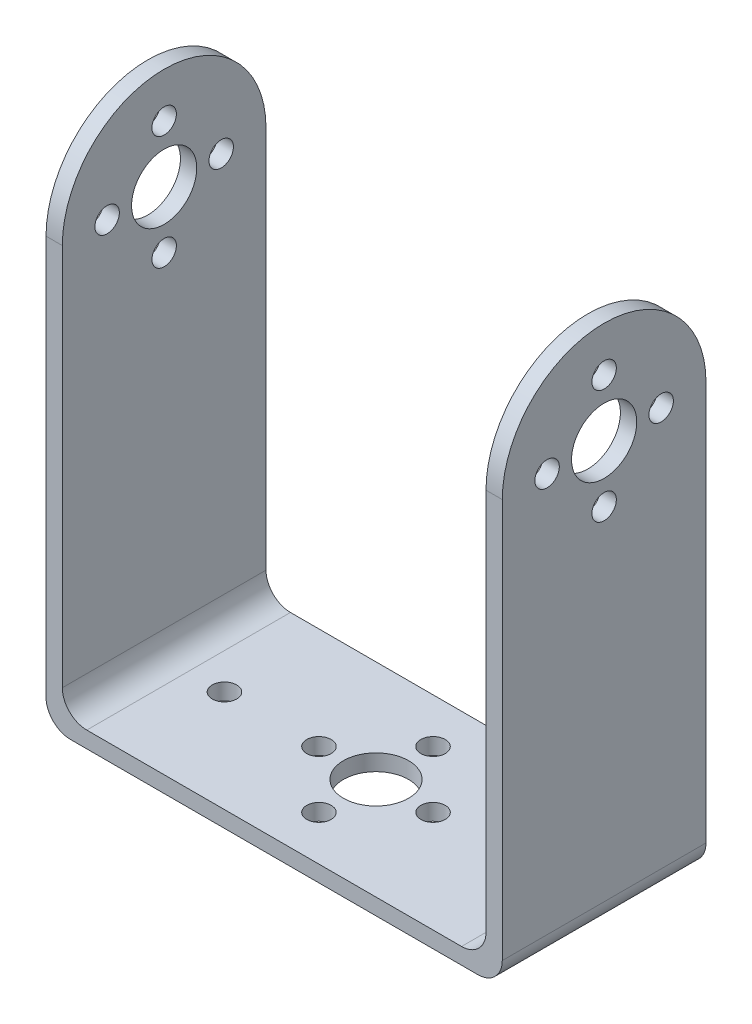
from build123d import *

# Parameters (mm, degrees)
SKETCH_1_W          = 52
SKETCH_1_H          = 25
SKETCH_1_R          = 1.5
SKETCH_1_R_2        = 4
EXTRUDE_1_DEPTH     = 2
SKETCH_2_W          = 2
SKETCH_2_H          = 25
EXTRUDE_2_DEPTH     = 64.5
CUT_EXTRUDE_2_REACH = 91.001
SKETCH_3_R          = 1.5
FILLET_1_R          = 3


with BuildPart() as part:
    # 草图1 → 凸台-拉伸1 (new body)
    with BuildSketch(Plane(origin=(0, 0, 0), x_dir=(1, 0, 0), z_dir=(0, 1, 0))):
        with Locations((26, -12.5)):
            Rectangle(SKETCH_1_W, SKETCH_1_H)
        with Locations(Location((44.6, -12.5, 0), (0, 0, 270))):
            Circle(SKETCH_1_R, mode=Mode.SUBTRACT)
        with Locations(Location((26, -12.5, 0), (0, 0, 270))):
            Circle(SKETCH_1_R_2, mode=Mode.SUBTRACT)
        with Locations(Location((26, -19.5, 0), (0, 0, 270))):
            Circle(SKETCH_1_R, mode=Mode.SUBTRACT)
        with Locations(Location((19, -12.5, 0), (0, 0, 270))):
            Circle(SKETCH_1_R, mode=Mode.SUBTRACT)
        with Locations(Location((26, -5.5, 0), (0, 0, 270))):
            Circle(SKETCH_1_R, mode=Mode.SUBTRACT)
        with Locations(Location((33, -12.5, 0), (0, 0, 270))):
            Circle(SKETCH_1_R, mode=Mode.SUBTRACT)
        with Locations(Location((7.4, -12.5, 0), (0, 0, 90))):
            Circle(SKETCH_1_R, mode=Mode.SUBTRACT)
    extrude(amount=EXTRUDE_1_DEPTH)

    # 草图2 → 凸台-拉伸2 (add)
    with BuildSketch(Plane(origin=(0, 0, 0), x_dir=(1, 0, 0), z_dir=(0, 1, 0))):
        with Locations((-1, -12.5)):
            Rectangle(SKETCH_2_W, SKETCH_2_H)
        with Locations((53, -12.5)):
            Rectangle(SKETCH_2_W, SKETCH_2_H)
    extrude(amount=EXTRUDE_2_DEPTH)

    # 切除-拉伸2: up to this face of the body (flat: up to its plane)
    cut_extrude_2_end = Plane(part.part.faces().sort_by_distance((54, 32.25, 12.5))[0])
    # 草图3 → 切除-拉伸2 (cut, up to the picked face)
    with BuildSketch(Plane.ZY.offset(2), mode=Mode.PRIVATE) as cut_extrude_2_sk1:
        with BuildLine():
            Line((0, 64.5), (0, 52))
            ThreePointArc((0, 52), (3.661165235, 60.838834765), (12.5, 64.5))
            Line((12.5, 64.5), (0, 64.5))
        make_face()
    cut_extrude_2_tool1 = split(extrude(cut_extrude_2_sk1.sketch, amount=-CUT_EXTRUDE_2_REACH, mode=Mode.PRIVATE), bisect_by=cut_extrude_2_end, keep=Keep.BOTH, mode=Mode.PRIVATE)
    # 草图3 → 切除-拉伸2 (cut, up to the picked face)
    with BuildSketch(Plane.ZY.offset(2), mode=Mode.PRIVATE) as cut_extrude_2_sk2:
        with BuildLine():
            Line((25, 64.5), (12.5, 64.5))
            ThreePointArc((12.5, 64.5), (21.338834765, 60.838834765), (25, 52))
            Line((25, 52), (25, 64.5))
        make_face()
    cut_extrude_2_tool2 = split(extrude(cut_extrude_2_sk2.sketch, amount=-CUT_EXTRUDE_2_REACH, mode=Mode.PRIVATE), bisect_by=cut_extrude_2_end, keep=Keep.BOTH, mode=Mode.PRIVATE)
    # 草图3 → 切除-拉伸2 (cut, up to the picked face)
    with BuildSketch(Plane.ZY.offset(2), mode=Mode.PRIVATE) as cut_extrude_2_sk3:
        with BuildLine():
            ThreePointArc((16.5, 52), (12.5, 56), (8.5, 52))
            Line((8.5, 52), (16.5, 52))
        make_face()
    cut_extrude_2_tool3 = split(extrude(cut_extrude_2_sk3.sketch, amount=-CUT_EXTRUDE_2_REACH, mode=Mode.PRIVATE), bisect_by=cut_extrude_2_end, keep=Keep.BOTH, mode=Mode.PRIVATE)
    # 草图3 → 切除-拉伸2 (cut, up to the picked face)
    with BuildSketch(Plane.ZY.offset(2), mode=Mode.PRIVATE) as cut_extrude_2_sk4:
        with BuildLine():
            Line((16.5, 52), (8.5, 52))
            ThreePointArc((8.5, 52), (12.5, 48), (16.5, 52))
        make_face()
    cut_extrude_2_tool4 = split(extrude(cut_extrude_2_sk4.sketch, amount=-CUT_EXTRUDE_2_REACH, mode=Mode.PRIVATE), bisect_by=cut_extrude_2_end, keep=Keep.BOTH, mode=Mode.PRIVATE)
    # 草图3 → 切除-拉伸2 (cut, up to the picked face)
    with BuildSketch(Plane.ZY.offset(2), mode=Mode.PRIVATE) as cut_extrude_2_sk5:
        with BuildLine():
            ThreePointArc((16.5, 52), (12.5, 56), (8.5, 52))
            Line((8.5, 52), (16.5, 52))
        make_face()
    cut_extrude_2_tool5 = split(extrude(cut_extrude_2_sk5.sketch, amount=-CUT_EXTRUDE_2_REACH, mode=Mode.PRIVATE), bisect_by=cut_extrude_2_end, keep=Keep.BOTH, mode=Mode.PRIVATE)
    # 草图3 → 切除-拉伸2 (cut, up to the picked face)
    with BuildSketch(Plane.ZY.offset(2), mode=Mode.PRIVATE) as cut_extrude_2_sk6:
        with BuildLine():
            Line((16.5, 52), (8.5, 52))
            ThreePointArc((8.5, 52), (12.5, 48), (16.5, 52))
        make_face()
    cut_extrude_2_tool6 = split(extrude(cut_extrude_2_sk6.sketch, amount=-CUT_EXTRUDE_2_REACH, mode=Mode.PRIVATE), bisect_by=cut_extrude_2_end, keep=Keep.BOTH, mode=Mode.PRIVATE)
    # 草图3 → 切除-拉伸2 (cut, up to the picked face)
    with BuildSketch(Plane.ZY.offset(2), mode=Mode.PRIVATE) as cut_extrude_2_sk7:
        with Locations((12.5, 45)):
            Circle(SKETCH_3_R)
    cut_extrude_2_tool7 = split(extrude(cut_extrude_2_sk7.sketch, amount=-CUT_EXTRUDE_2_REACH, mode=Mode.PRIVATE), bisect_by=cut_extrude_2_end, keep=Keep.BOTH, mode=Mode.PRIVATE)
    # 草图3 → 切除-拉伸2 (cut, up to the picked face)
    with BuildSketch(Plane.ZY.offset(2), mode=Mode.PRIVATE) as cut_extrude_2_sk8:
        with Locations((12.5, 59)):
            Circle(SKETCH_3_R)
    cut_extrude_2_tool8 = split(extrude(cut_extrude_2_sk8.sketch, amount=-CUT_EXTRUDE_2_REACH, mode=Mode.PRIVATE), bisect_by=cut_extrude_2_end, keep=Keep.BOTH, mode=Mode.PRIVATE)
    # 草图3 → 切除-拉伸2 (cut, up to the picked face)
    with BuildSketch(Plane.ZY.offset(2), mode=Mode.PRIVATE) as cut_extrude_2_sk9:
        with Locations((5.5, 52)):
            Circle(SKETCH_3_R)
    cut_extrude_2_tool9 = split(extrude(cut_extrude_2_sk9.sketch, amount=-CUT_EXTRUDE_2_REACH, mode=Mode.PRIVATE), bisect_by=cut_extrude_2_end, keep=Keep.BOTH, mode=Mode.PRIVATE)
    # 草图3 → 切除-拉伸2 (cut, up to the picked face)
    with BuildSketch(Plane.ZY.offset(2), mode=Mode.PRIVATE) as cut_extrude_2_sk10:
        with Locations((19.5, 52)):
            Circle(SKETCH_3_R)
    cut_extrude_2_tool10 = split(extrude(cut_extrude_2_sk10.sketch, amount=-CUT_EXTRUDE_2_REACH, mode=Mode.PRIVATE), bisect_by=cut_extrude_2_end, keep=Keep.BOTH, mode=Mode.PRIVATE)
    add(cut_extrude_2_tool1.solids().sort_by(Axis((-2, 61.707901, 2.792099), (1, 0, 0)))[0], mode=Mode.SUBTRACT)
    add(cut_extrude_2_tool2.solids().sort_by(Axis((-2, 61.707901, 22.207901), (1, 0, 0)))[0], mode=Mode.SUBTRACT)
    add(cut_extrude_2_tool3.solids().sort_by(Axis((-2, 53.697653, 12.5), (1, 0, 0)))[0], mode=Mode.SUBTRACT)
    add(cut_extrude_2_tool4.solids().sort_by(Axis((-2, 50.302347, 12.5), (1, 0, 0)))[0], mode=Mode.SUBTRACT)
    add(cut_extrude_2_tool5.solids().sort_by(Axis((-2, 53.697653, 12.5), (1, 0, 0)))[0], mode=Mode.SUBTRACT)
    add(cut_extrude_2_tool6.solids().sort_by(Axis((-2, 50.302347, 12.5), (1, 0, 0)))[0], mode=Mode.SUBTRACT)
    add(cut_extrude_2_tool7.solids().sort_by(Axis((-2, 45, 12.5), (1, 0, 0)))[0], mode=Mode.SUBTRACT)
    add(cut_extrude_2_tool8.solids().sort_by(Axis((-2, 59, 12.5), (1, 0, 0)))[0], mode=Mode.SUBTRACT)
    add(cut_extrude_2_tool9.solids().sort_by(Axis((-2, 52, 5.5), (1, 0, 0)))[0], mode=Mode.SUBTRACT)
    add(cut_extrude_2_tool10.solids().sort_by(Axis((-2, 52, 19.5), (1, 0, 0)))[0], mode=Mode.SUBTRACT)

    # 圆角1
    fillet_1_edges = [part.edges().sort_by_distance(p)[0] for p in [
        (52, 2, 12.5),
        (0, 2, 12.5),
        (-2, 0, 12.5),
        (54, 0, 12.5),
    ]]
    fillet(fillet_1_edges, radius=FILLET_1_R)


solid = part.part
